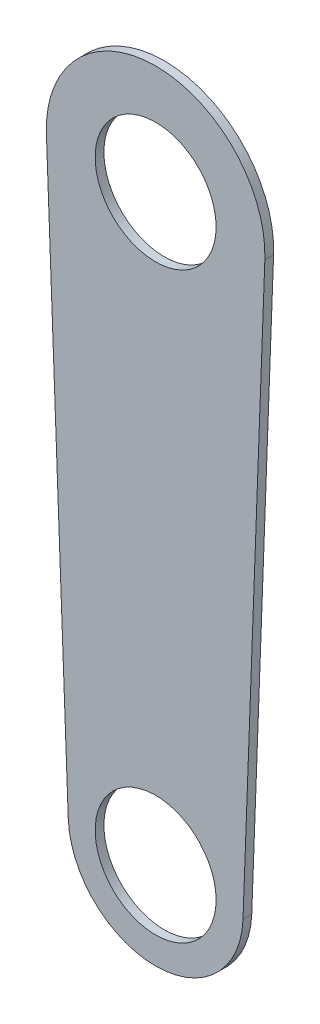
from build123d import *

# Parameters (mm, degrees)
SKETCH_1_R      = 41.5
EXTRUDE_1_DEPTH = 6


with BuildPart() as part:
    # 草图1 → 凸台-拉伸1 (new body)
    with BuildSketch(Plane.XY):
        with BuildLine():
            Line((-74.947247073, -2.8125), (-59.957797658, -402.25))
            ThreePointArc((-59.957797658, -402.25), (0, -460), (59.957797658, -402.25))
            Line((59.957797658, -402.25), (74.947247073, -2.8125))
            ThreePointArc((74.947247073, -2.8125), (0, 75), (-74.947247073, -2.8125))
        make_face()
        Circle(SKETCH_1_R, mode=Mode.SUBTRACT)
        with Locations((0, -400)):
            Circle(SKETCH_1_R, mode=Mode.SUBTRACT)
    extrude(amount=EXTRUDE_1_DEPTH)


solid = part.part
